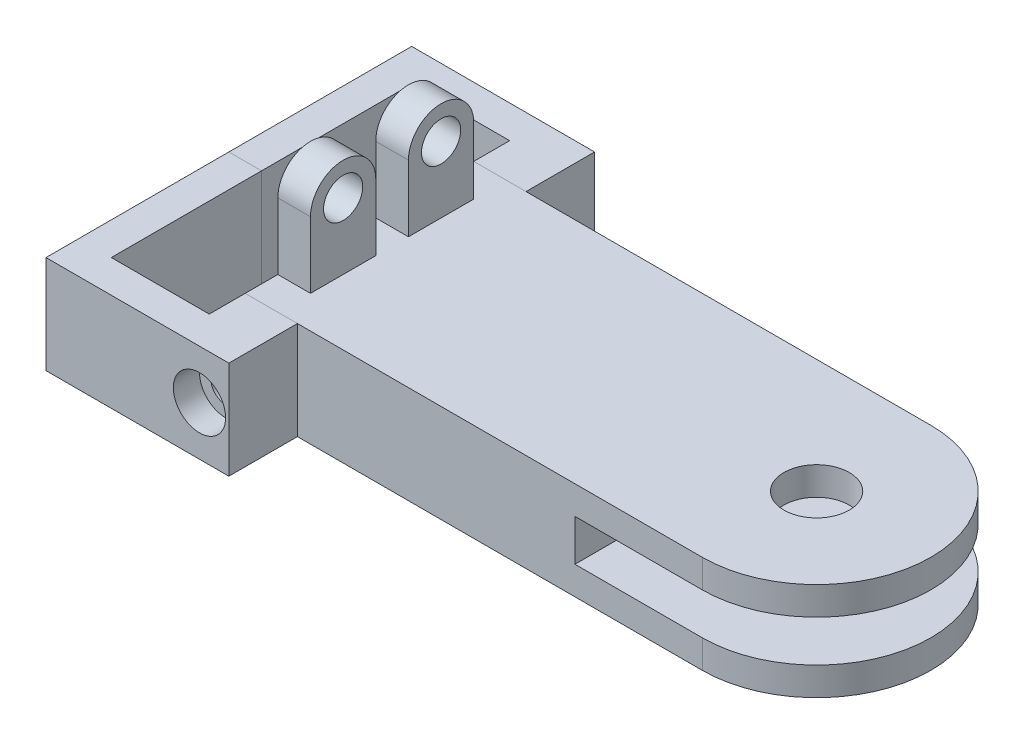
from build123d import *

# Parameters (mm, degrees)
SKETCH1_R                       = 5
BOSS_EXTRUDE2_DEPTH             = 7.5
CUT_EXTRUDE2_DEPTH              = 73.543090643
CUT_EXTRUDE2_DEPTH_BACK         = 73.543090643
SKETCH4_W                       = 37
SKETCH4_H                       = 6.35
SKETCH6_R                       = 3
BOSS_EXTRUDE5_DEPTH             = 5
BOSS_EXTRUDE6_REACH             = 77.629
BOSS_EXTRUDE6_DIRECTION_2_REACH = 77.629
SKETCH9_R                       = 2.5
BOSS_EXTRUDE7_DEPTH             = 3
SKETCH15_W                      = 2
SKETCH15_H                      = 45.5


with BuildPart() as part:
    # Sketch1 → Boss-Extrude2 (new, symmetric)
    with BuildSketch(Plane(origin=(0, 0, 0), x_dir=(1, 0, 0), z_dir=(0, 1, 0))):
        with BuildLine():
            Line((0, 17.5), (-70, 17.5))
            Line((-70, 17.5), (-70, -17.5))
            Line((-70, -17.5), (0, -17.5))
            ThreePointArc((0, -17.5), (17.5, 0), (0, 17.5))
        make_face()
        with Locations(Location((0, 0, 0), (0, 0, 270))):
            Circle(SKETCH1_R, mode=Mode.SUBTRACT)
    extrude(amount=BOSS_EXTRUDE2_DEPTH, both=True)

    # Sketch4 → Cut-Extrude2 (cut, two sides: drawn at the far end of the back side and taken through both)
    with BuildSketch(Plane.XY.offset(-CUT_EXTRUDE2_DEPTH_BACK)):
        with Locations((-1, 0)):
            Rectangle(SKETCH4_W, SKETCH4_H)
    extrude(amount=CUT_EXTRUDE2_DEPTH + CUT_EXTRUDE2_DEPTH_BACK, mode=Mode.SUBTRACT)

    # Sketch6 → Boss-Extrude5 (add)
    # profile 1 of 2: a face of its own
    with BuildSketch(Plane.ZY.offset(70)):
        with BuildLine():
            Line((-12.5, 7.5), (-2.5, 7.5))
            Line((-2.5, 7.5), (-2.5, 17.66))
            ThreePointArc((-2.5, 17.66), (-7.5, 22.66), (-12.5, 17.66))
            Line((-12.5, 17.66), (-12.5, 7.5))
        make_face()
        with Locations((-7.5, 17.66)):
            Circle(SKETCH6_R, mode=Mode.SUBTRACT)
    # profile 2 of 2: a face of its own
    with BuildSketch(Plane.ZY.offset(70)):
        with BuildLine():
            Line((12.5, 7.5), (2.5, 7.5))
            Line((2.5, 7.5), (2.5, 17.66))
            ThreePointArc((2.5, 17.66), (7.5, 22.66), (12.5, 17.66))
            Line((12.5, 17.66), (12.5, 7.5))
        make_face()
        with Locations((7.5, 17.66)):
            Circle(SKETCH6_R, mode=Mode.SUBTRACT)
    extrude(amount=-BOSS_EXTRUDE5_DEPTH)


with BuildPart() as body_2:

    # Boss-Extrude6: up to this face of the body (flat: up to its plane)
    boss_extrude6_end = Plane(part.part.faces().sort_by_distance((-27.402953524, 7.5, 0))[0])
    # Sketch8 → Boss-Extrude6 (new, up to the picked face)
    with BuildSketch(Plane(origin=(0, 0, 0), x_dir=(1, 0, 0), z_dir=(0, 1, 0)), mode=Mode.PRIVATE) as boss_extrude6_sk1:
        Polygon((-62, 17.5), (-70, 17.5), (-70, 23), (-85, 23), (-85, 17.5), (-85, 0), (-90, 0), (-90, 17.5), (-90, 28), (-62, 28), align=None)
    boss_extrude6_tool1 = split(extrude(boss_extrude6_sk1.sketch, amount=BOSS_EXTRUDE6_REACH, mode=Mode.PRIVATE), bisect_by=boss_extrude6_end, keep=Keep.BOTH, mode=Mode.PRIVATE)
    add(boss_extrude6_tool1.solids().sort_by(Axis((-66, 0, -17.89598), (0, 1, 0)))[0])


    # Boss-Extrude6 direction 2: up to this face of the body (flat: up to its plane)
    boss_extrude6_direction_2_end = Plane(part.part.faces().sort_by_distance((-28.808626222, -7.5, 0))[0])
    # Sketch8 → Boss-Extrude6 direction 2 (add, up to the picked face)
    with BuildSketch(Plane(origin=(0, 0, 0), x_dir=(1, 0, 0), z_dir=(0, 1, 0)), mode=Mode.PRIVATE) as boss_extrude6_direction_2_sk1:
        Polygon((-62, 17.5), (-70, 17.5), (-70, 23), (-85, 23), (-85, 17.5), (-85, 0), (-90, 0), (-90, 17.5), (-90, 28), (-62, 28), align=None)
    boss_extrude6_direction_2_tool1 = split(extrude(boss_extrude6_direction_2_sk1.sketch, amount=-BOSS_EXTRUDE6_DIRECTION_2_REACH, mode=Mode.PRIVATE), bisect_by=boss_extrude6_direction_2_end, keep=Keep.BOTH, mode=Mode.PRIVATE)
    add(boss_extrude6_direction_2_tool1.solids().sort_by(Axis((-66, 0, -17.89598), (0, -1, 0)))[0])

    # Sketch9 → Boss-Extrude7 (add)
    with BuildSketch(Plane.XY.offset(-23)):
        with Locations(Location((-77.5, 0, 0), (0, 0, 180))):
            Circle(SKETCH9_R)
    extrude(amount=BOSS_EXTRUDE7_DEPTH)


with BuildPart() as body_3:
    # Mirror3: mirrored copy
    add(body_2.part.mirror(Plane.XY))


with BuildPart() as cbore_for_m4_shcs1_tool:
    # Sketch13 → CBORE for M4 SHCS1 (revolve)
    with BuildSketch(Plane(origin=(-66.5, 0, 28), x_dir=(0, -1, 0), z_dir=(1, 0, 0))):
        Polygon((0, 0), (0, 11.851936393), (2.25, 10.5), (2.25, 4), (4, 4), (4, 0), align=None)
    cbore_for_m4_shcs1 = revolve(axis=Axis((-66.5, 0, 34.35), (0, 0, -1)))


with BuildPart() as part_1:
    add(part.part)

    # CBORE for M4 SHCS1: cut by cbore_for_m4_shcs1_tool
    add(cbore_for_m4_shcs1_tool.part, mode=Mode.SUBTRACT)


with BuildPart() as body_3_1:
    add(body_3.part)

    # CBORE for M4 SHCS1: cut by cbore_for_m4_shcs1_tool
    add(cbore_for_m4_shcs1_tool.part, mode=Mode.SUBTRACT)


with BuildPart() as mirror5_tool:
    # Mirror5: CBORE for M4 SHCS1 across plane
    add(cbore_for_m4_shcs1.mirror(Plane.XY))


with BuildPart() as part_2:
    add(part_1.part)

    # Mirror5: cut by mirror5_tool
    add(mirror5_tool.part, mode=Mode.SUBTRACT)

    # Sketch15 → Ø4.0mm Dowel Hole1 (revolve, cut)
    with BuildSketch(Plane(origin=(-66.5, 0, 17.5), x_dir=(0, -1, 0), z_dir=(1, 0, 0))):
        with Locations((1, 22.75)):
            Rectangle(SKETCH15_W, SKETCH15_H)
    revolve(axis=Axis((-66.5, 0, 23.85), (0, 0, -1)), mode=Mode.SUBTRACT)


with BuildPart() as body_2_1:
    add(body_2.part)

    # Mirror5: cut by mirror5_tool
    add(mirror5_tool.part, mode=Mode.SUBTRACT)


solid = Compound([body_3_1.part, part_2.part, body_2_1.part])
